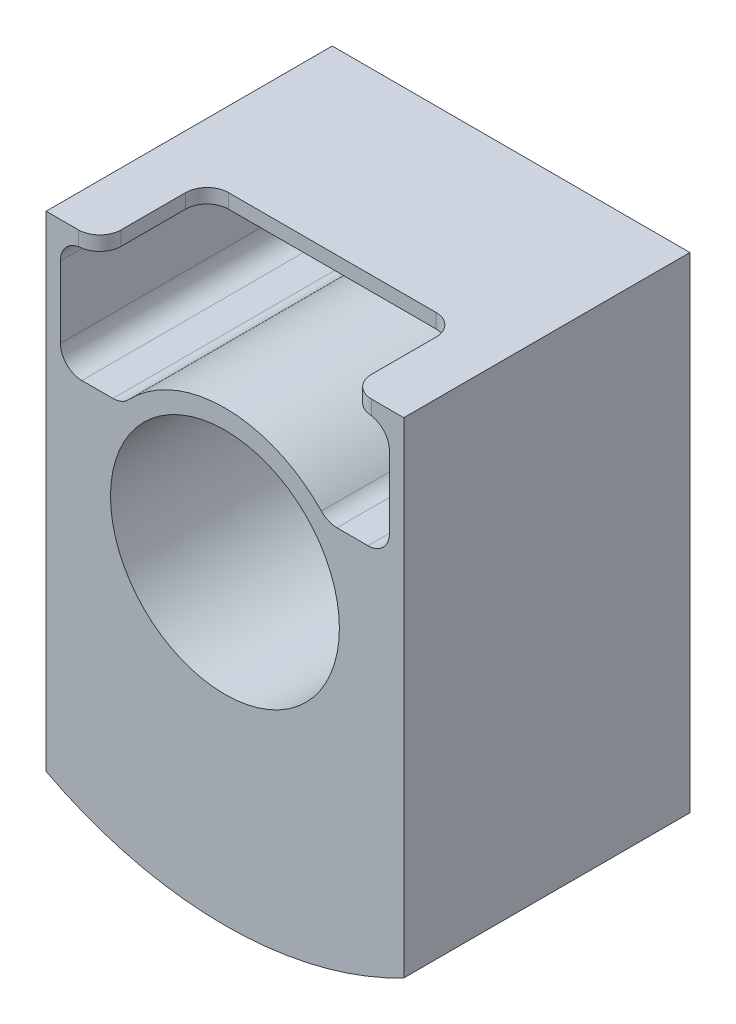
from build123d import *

# Parameters (mm, degrees)
BOSS_EXTRUDE2_DEPTH     = 40
CUT_EXTRUDE1_DEPTH      = 72.681940717
CUT_EXTRUDE1_DEPTH_BACK = 72.681940717
SKETCH2_R               = 16
CUT_EXTRUDE3_DEPTH      = 72.681940717
FILLET1_R               = 3
SKETCH5_W               = 35
SKETCH5_H               = 15
CUT_EXTRUDE4_DEPTH      = 10
FILLET2_R               = 3


with BuildPart() as part:
    # Sketch1 → Boss-Extrude2 (new body)
    with BuildSketch(Plane.XY):
        with BuildLine():
            Line((-25, 0), (-25, -47.83618531))
            ThreePointArc((-25, -47.83618531), (0, -53.975), (25, -47.83618531))
            Line((25, -47.83618531), (25, 0))
            Line((25, 0), (25, 20))
            Line((25, 20), (-25, 20))
            Line((-25, 20), (-25, 0))
        make_face()
    extrude(amount=BOSS_EXTRUDE2_DEPTH)

    # Sketch2 → Cut-Extrude1 (cut, two sides: drawn at the far end of the back side and taken through both)
    with BuildSketch(Plane.XY.offset(40).offset(-CUT_EXTRUDE1_DEPTH_BACK)):
        with Locations((0, -10)):
            Circle(SKETCH2_R)
    extrude(amount=CUT_EXTRUDE1_DEPTH + CUT_EXTRUDE1_DEPTH_BACK, mode=Mode.SUBTRACT)

    # Sketch4 → Cut-Extrude3 (cut, through all)
    with BuildSketch(Plane.XY.offset(40)):
        with BuildLine():
            Line((-23, 18), (23, 18))
            Line((23, 18), (23, 2))
            Line((23, 2), (14.317821063, 2))
            ThreePointArc((14.317821063, 2), (0, 8.681541692), (-14.317821063, 2))
            Line((-14.317821063, 2), (-23, 2))
            Line((-23, 2), (-23, 18))
        make_face()
    extrude(amount=-CUT_EXTRUDE3_DEPTH, mode=Mode.SUBTRACT)

    # Fillet1
    fillet1_edges = [part.edges().sort_by_distance(p)[0] for p in [
        (23, 18, 20),
        (23, 2, 20),
        (14.317821063, 2, 20),
        (-14.317821063, 2, 20),
        (-23, 2, 20),
        (-23, 18, 20),
    ]]
    fillet(fillet1_edges, radius=FILLET1_R)

    # Sketch5 → Cut-Extrude4 (cut)
    with BuildSketch(Plane(origin=(0, 20, 0), x_dir=(1, 0, 0), z_dir=(0, 1, 0))):
        with Locations((0, -32.5)):
            Rectangle(SKETCH5_W, SKETCH5_H)
    extrude(amount=-CUT_EXTRUDE4_DEPTH, mode=Mode.SUBTRACT)

    # Fillet2
    fillet2_edges = [part.edges().sort_by_distance(p)[0] for p in [
        (17.5, 19, 40),
        (17.5, 19, 25),
        (-17.5, 19, 25),
        (-17.5, 19, 40),
    ]]
    fillet(fillet2_edges, radius=FILLET2_R)


solid = part.part
